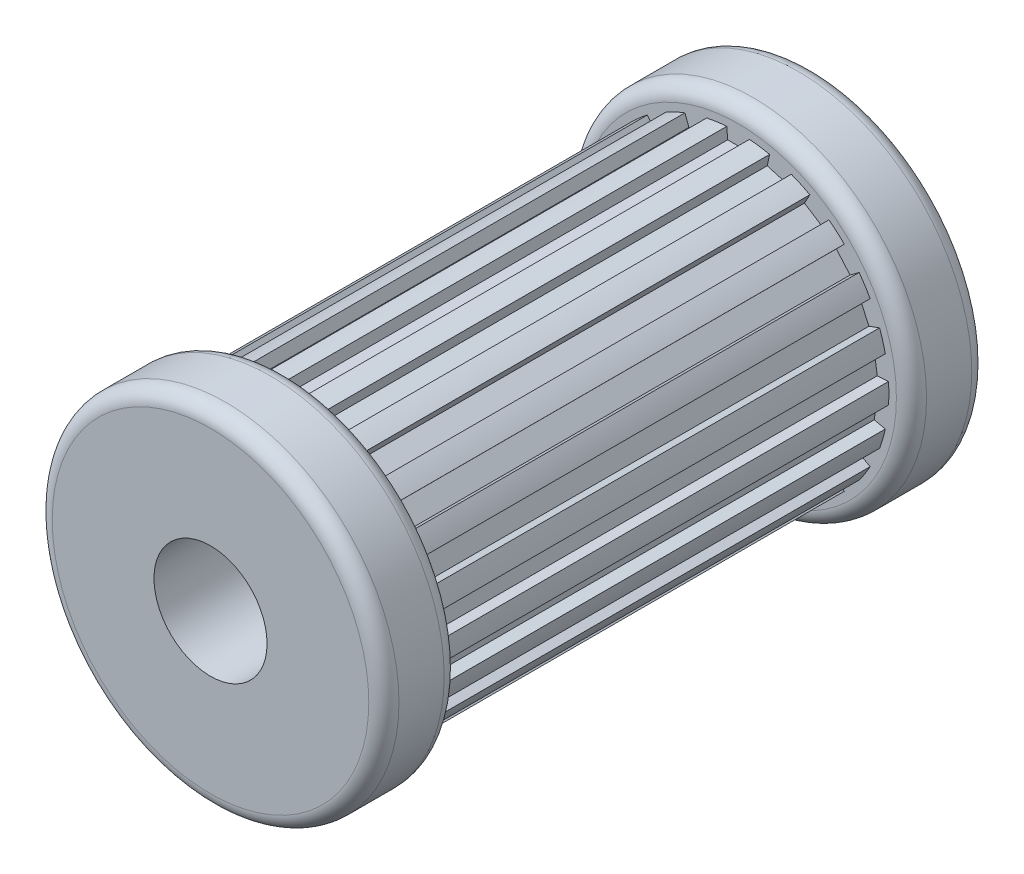
from build123d import *

# Parameters (mm, degrees)
SKETCH1_R           = 20
BOSS_EXTRUDE1_DEPTH = 35
CUT_EXTRUDE1_DEPTH  = 76.498344353
CIRPATTERN1_COUNT   = 22
SKETCH3_R           = 23
BOSS_EXTRUDE2_DEPTH = 10
BOSS_EXTRUDE3_START = -70
SKETCH3_2_R         = 23
BOSS_EXTRUDE3_DEPTH = 10
SKETCH4_R           = 7.5
CUT_EXTRUDE2_DEPTH  = 87.35971283
FILLET2_R           = 2


with BuildPart() as part:
    # Sketch1 → Boss-Extrude1 (new, symmetric)
    with BuildSketch(Plane.XY):
        Circle(SKETCH1_R)
    extrude(amount=BOSS_EXTRUDE1_DEPTH, both=True)

    # Sketch2 → Cut-Extrude1 (cut, through all)
    with BuildSketch(Plane.XY.offset(35)):
        with BuildLine():
            Line((0, 20), (0, 18.447895375))
            Line((0, 18.447895375), (1.3875, 18.447895375))
            Line((1.3875, 18.447895375), (1.5, 19.943670675))
            ThreePointArc((1.5, 19.943670675), (0.750528646, 19.985912707), (0, 20))
        make_face()
        with BuildLine():
            Line((-1.3875, 18.447895375), (0, 18.447895375))
            Line((0, 18.447895375), (0, 20))
            ThreePointArc((0, 20), (-0.750528646, 19.985912707), (-1.5, 19.943670675))
            Line((-1.5, 19.943670675), (-1.3875, 18.447895375))
        make_face()
    cut_extrude1 = extrude(amount=-CUT_EXTRUDE1_DEPTH, mode=Mode.SUBTRACT)

    # CirPattern1: Cut-Extrude1 ×22 about axis
    cirpattern1_axis = Axis((0, 0, 0), (0, 0, 1))
    for i in range(1, CIRPATTERN1_COUNT):
        add(cut_extrude1.rotate(cirpattern1_axis, i * 360 / CIRPATTERN1_COUNT), mode=Mode.SUBTRACT)

    # Sketch3 → Boss-Extrude2 (add)
    with BuildSketch(Plane.XY.offset(35)):
        Circle(SKETCH3_R)
    extrude(amount=-BOSS_EXTRUDE2_DEPTH)

    # Sketch3<2> → Boss-Extrude3 (add)
    with BuildSketch(Plane.XY.offset(35).offset(BOSS_EXTRUDE3_START)):
        Circle(SKETCH3_2_R)
    extrude(amount=-BOSS_EXTRUDE3_DEPTH)

    # Sketch4 → Cut-Extrude2 (cut, through all)
    with BuildSketch(Plane.XY.offset(35)):
        Circle(SKETCH4_R)
    extrude(amount=-CUT_EXTRUDE2_DEPTH, mode=Mode.SUBTRACT)

    # Fillet2
    fillet2_edges = [part.edges().sort_by_distance(p)[0] for p in [
        (-23, 0, 35),
        (-23, 0, 25),
        (-23, 0, -35),
        (-23, 0, -45),
    ]]
    fillet(fillet2_edges, radius=FILLET2_R)


solid = part.part
